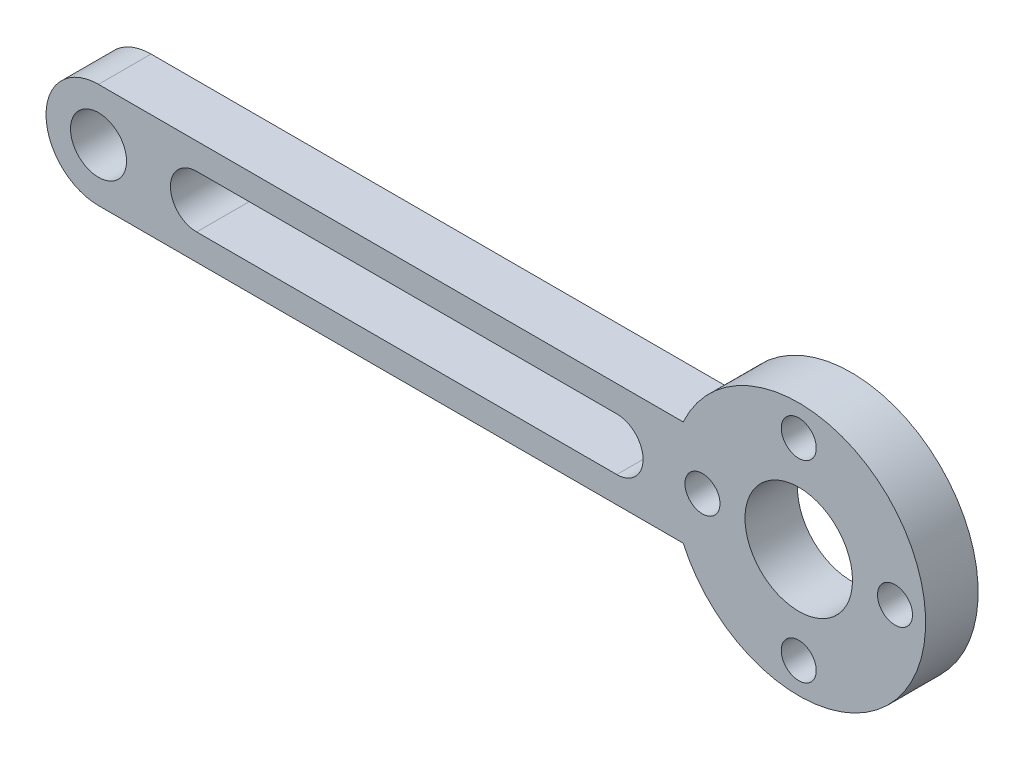
from build123d import *

# Parameters (mm, degrees)
SKETCH_1_R      = 1
SKETCH_1_R_2    = 1.6
SKETCH_1_R_3    = 3.071217349
EXTRUDE_2_DEPTH = 3


with BuildPart() as part:
    # 草图1 → 凸台-拉伸2 (new body)
    with BuildSketch(Plane.XY):
        with BuildLine():
            Line((12, -8), (45.399810609, -8))
            ThreePointArc((45.399810609, -8), (59.25, -5), (45.399810609, -2))
            Line((45.399810609, -2), (12, -2))
            ThreePointArc((12, -2), (9, -5), (12, -8))
        make_face()
        with Locations((52, 0.5)):
            Circle(SKETCH_1_R, mode=Mode.SUBTRACT)
        with Locations((52, -10.5)):
            Circle(SKETCH_1_R, mode=Mode.SUBTRACT)
        with Locations((12, -5)):
            Circle(SKETCH_1_R_2, mode=Mode.SUBTRACT)
        with Locations((52, -5)):
            Circle(SKETCH_1_R_3, mode=Mode.SUBTRACT)
        with Locations((57.5, -5)):
            Circle(SKETCH_1_R, mode=Mode.SUBTRACT)
        with Locations((46.5, -5)):
            Circle(SKETCH_1_R, mode=Mode.SUBTRACT)
        with BuildLine():
            ThreePointArc((41.607192878, -6.5), (43.107192878, -5), (41.607192878, -3.5))
            Line((41.607192878, -3.5), (17.607192878, -3.5))
            ThreePointArc((17.607192878, -3.5), (16.107192878, -5), (17.607192878, -6.5))
            Line((17.607192878, -6.5), (41.607192878, -6.5))
        make_face(mode=Mode.SUBTRACT)
    extrude(amount=EXTRUDE_2_DEPTH)


solid = part.part
